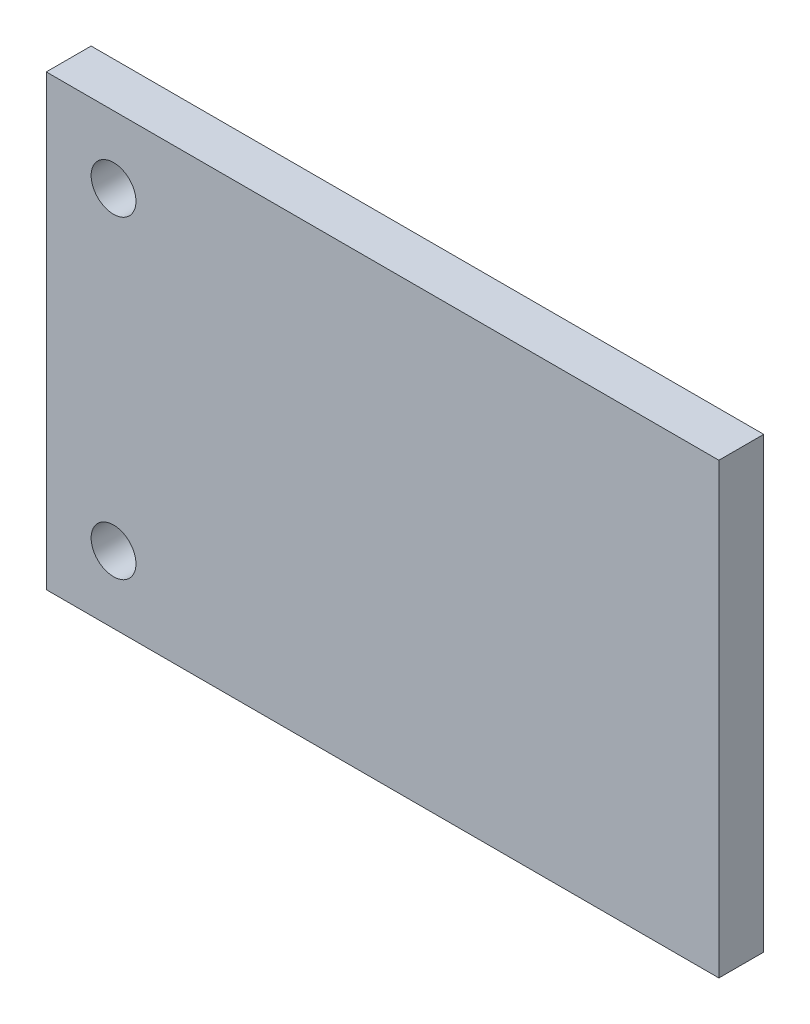
from build123d import *

# Parameters (mm, degrees)
SZKIC1_W                    = 300
SZKIC1_H                    = 200
SZKIC1_R                    = 10
DODANIE_WYCI_GNI_CIE1_DEPTH = 20


with BuildPart() as part:
    # Szkic1 → Dodanie-wyciągnięcie1 (new body)
    with BuildSketch(Plane.XY):
        with Locations((150, -100)):
            Rectangle(SZKIC1_W, SZKIC1_H)
        with Locations((30, -170)):
            Circle(SZKIC1_R, mode=Mode.SUBTRACT)
        with Locations((30, -30)):
            Circle(SZKIC1_R, mode=Mode.SUBTRACT)
    extrude(amount=DODANIE_WYCI_GNI_CIE1_DEPTH)


solid = part.part
